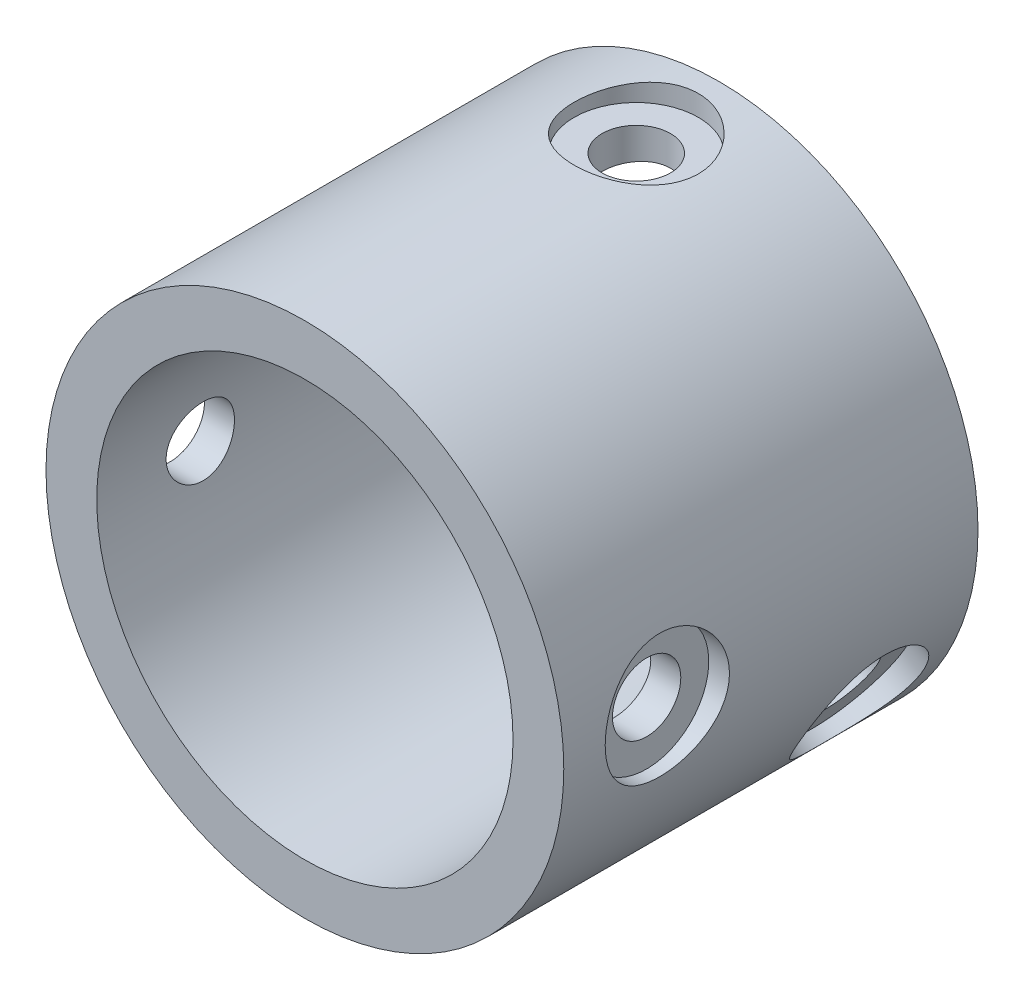
from build123d import *

# Parameters (mm, degrees)
SKETCH1_R               = 12.5
SKETCH1_R_2             = 10.05
BOSS_EXTRUDE1_DEPTH     = 20
SKETCH3_R               = 1.65
CUT_EXTRUDE1_DEPTH      = 4
CIRPATTERN1_COUNT       = 3
SKETCH5_R               = 3
CUT_EXTRUDE3_DEPTH      = 1
CIRPATTERN2_COUNT       = 3
CUT_EXTRUDE5_DEPTH      = 35.369317885
CUT_EXTRUDE5_DEPTH_BACK = 35.369317885
SKETCH7_R               = 1.65
SKETCH8_R               = 3
CUT_EXTRUDE6_DEPTH      = 1
CIRPATTERN6_COUNT       = 2


with BuildPart() as part:
    # Sketch1 → Boss-Extrude1 (new body)
    with BuildSketch(Plane.XY):
        Circle(SKETCH1_R)
        Circle(SKETCH1_R_2, mode=Mode.SUBTRACT)
    extrude(amount=BOSS_EXTRUDE1_DEPTH)

    # Sketch3 → Cut-Extrude1 (cut)
    with BuildSketch(Plane(origin=(-10.825317547, -6.25, 0), x_dir=(0, 0, 1), z_dir=(-0.8660254037844362, -0.5000000000000046, 0))):
        with Locations(Location((4, 0, 0), (0, 0, 270))):
            Circle(SKETCH3_R)
    cut_extrude1 = extrude(amount=-CUT_EXTRUDE1_DEPTH, mode=Mode.SUBTRACT)

    # CirPattern1: Cut-Extrude1 ×3 about axis
    cirpattern1_axis = Axis((0, 0, 0), (0, 0, 1))
    for i in range(1, CIRPATTERN1_COUNT):
        add(cut_extrude1.rotate(cirpattern1_axis, i * 360 / CIRPATTERN1_COUNT), mode=Mode.SUBTRACT)

    # Sketch5 → Cut-Extrude3 (cut)
    with BuildSketch(Plane(origin=(-10.825317547, -6.25, 0), x_dir=(0, 0, 1), z_dir=(-0.8660254037844362, -0.5000000000000046, 0))):
        with Locations(Location((4, 0, 0), (0, 0, 270))):
            Circle(SKETCH5_R)
    cut_extrude3 = extrude(amount=-CUT_EXTRUDE3_DEPTH, mode=Mode.SUBTRACT)

    # CirPattern2: Cut-Extrude3 ×3 about axis
    cirpattern2_axis = Axis((0, 0, 0), (0, 0, 1))
    for i in range(1, CIRPATTERN2_COUNT):
        add(cut_extrude3.rotate(cirpattern2_axis, i * 360 / CIRPATTERN2_COUNT), mode=Mode.SUBTRACT)

    # Sketch7 → Cut-Extrude5 (cut, two sides: drawn at the far end of the back side and taken through both)
    with BuildSketch(Plane.ZY.offset(12.5).offset(-CUT_EXTRUDE5_DEPTH_BACK)):
        with Locations((15, 0)):
            Circle(SKETCH7_R)
    extrude(amount=CUT_EXTRUDE5_DEPTH + CUT_EXTRUDE5_DEPTH_BACK, mode=Mode.SUBTRACT)

    # Sketch8 → Cut-Extrude6 (cut)
    with BuildSketch(Plane.ZY.offset(12.5)):
        with Locations((15, 0)):
            Circle(SKETCH8_R)
    cut_extrude6 = extrude(amount=-CUT_EXTRUDE6_DEPTH, mode=Mode.SUBTRACT)

    # CirPattern6: Cut-Extrude6 ×2 about axis
    cirpattern6_axis = Axis((0, 0, 20), (0, 0, -1))
    for i in range(1, CIRPATTERN6_COUNT):
        add(cut_extrude6.rotate(cirpattern6_axis, i * 360 / CIRPATTERN6_COUNT), mode=Mode.SUBTRACT)


solid = part.part
